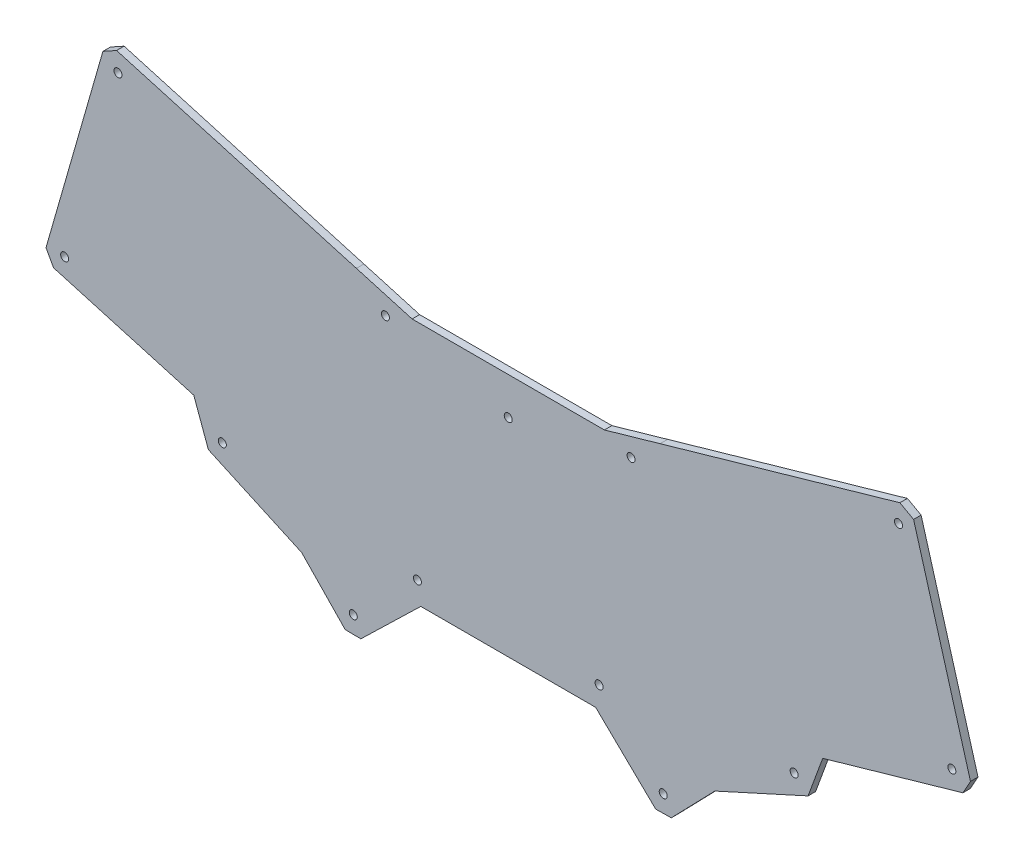
from build123d import *

# Parameters (mm, degrees)
ESQUISSE1_R        = 1.6
BOSS_EXTRU_1_DEPTH = 3


with BuildPart() as part:
    # Esquisse1 → Boss.-Extru.1 (new body)
    with BuildSketch(Plane.XY):
        Polygon((-324.146226634, 21.123080509), (-228.411595335, -6.322621021), (-221.686141291, -8.251113935), (-206.165691337, -12.701531345), (-167.175777529, -12.701531345), (-129.424828406, -12.701531345), (-123.517939729, -11.007758272), (-113.904378452, -8.251113935), (-107.178924408, -6.322621021), (-11.444293109, 21.123080509), (-5.984240232, 18.096325283), (16.733855492, -61.131089881), (13.707363231, -66.591026451), (-42.255771499, -82.638197107), (-48.091810819, -98.561018129), (-85.310364869, -115.48724507), (-102.69792658, -133.444615579), (-108.937044092, -133.542771169), (-132.888887149, -110.350948678), (-202.701632594, -110.350948678), (-226.653475651, -133.542771169), (-232.892593163, -133.444615579), (-250.280154874, -115.48724507), (-287.498708924, -98.561018129), (-293.334748244, -82.638197107), (-349.297882974, -66.591026451), (-352.324375235, -61.131089881), (-329.606279511, 18.096325283), align=None)
        with Locations((-12.000450916, 13.68165837)):
            Circle(ESQUISSE1_R, mode=Mode.SUBTRACT)
        with Locations((-118.757933777, -16.924131519)):
            Circle(ESQUISSE1_R, mode=Mode.SUBTRACT)
        with Locations((9.292284284, -60.574933915)):
            Circle(ESQUISSE1_R, mode=Mode.SUBTRACT)
        with Locations((-53.656180266, -93.401689518)):
            Circle(ESQUISSE1_R, mode=Mode.SUBTRACT)
        with Locations((-105.923928137, -126.713325795)):
            Circle(ESQUISSE1_R, mode=Mode.SUBTRACT)
        with Locations((-131.530967037, -101.880200807)):
            Circle(ESQUISSE1_R, mode=Mode.SUBTRACT)
        with Locations(Location((-204.059552706, -101.880200807, 0), (0, 0, 180))):
            Circle(ESQUISSE1_R, mode=Mode.SUBTRACT)
        with Locations(Location((-229.666591606, -126.713325795, 0), (0, 0, 180))):
            Circle(ESQUISSE1_R, mode=Mode.SUBTRACT)
        with Locations(Location((-281.934339477, -93.401689518, 0), (0, 0, 180))):
            Circle(ESQUISSE1_R, mode=Mode.SUBTRACT)
        with Locations(Location((-344.882804027, -60.574933915, 0), (0, 0, 180))):
            Circle(ESQUISSE1_R, mode=Mode.SUBTRACT)
        with Locations(Location((-216.832585966, -16.924131519, 0), (0, 0, 180))):
            Circle(ESQUISSE1_R, mode=Mode.SUBTRACT)
        with Locations(Location((-323.590068827, 13.68165837, 0), (0, 0, 180))):
            Circle(ESQUISSE1_R, mode=Mode.SUBTRACT)
        with Locations(Location((-167.795259872, -27.605548894, 0), (0, 0, 180))):
            Circle(ESQUISSE1_R, mode=Mode.SUBTRACT)
    extrude(amount=BOSS_EXTRU_1_DEPTH)


solid = part.part
